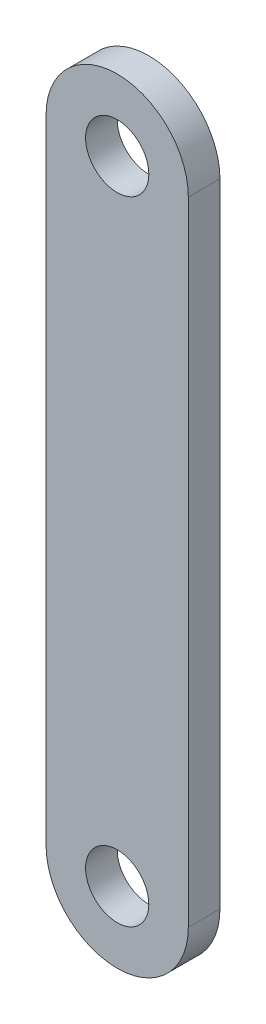
from build123d import *

# Parameters (mm, degrees)
CROQUIS1_R              = 10
SALIENTE_EXTRUIR1_DEPTH = 10


with BuildPart() as part:
    # Croquis1 → Saliente-Extruir1 (new body)
    with BuildSketch(Plane.XY):
        with BuildLine():
            Line((-22.5, 0), (-22.5, -200))
            ThreePointArc((-22.5, -200), (0, -222.5), (22.5, -200))
            Line((22.5, -200), (22.5, 0))
            ThreePointArc((22.5, 0), (0, 22.5), (-22.5, 0))
        make_face()
        Circle(CROQUIS1_R, mode=Mode.SUBTRACT)
        with Locations((0, -200)):
            Circle(CROQUIS1_R, mode=Mode.SUBTRACT)
    extrude(amount=SALIENTE_EXTRUIR1_DEPTH)


solid = part.part
